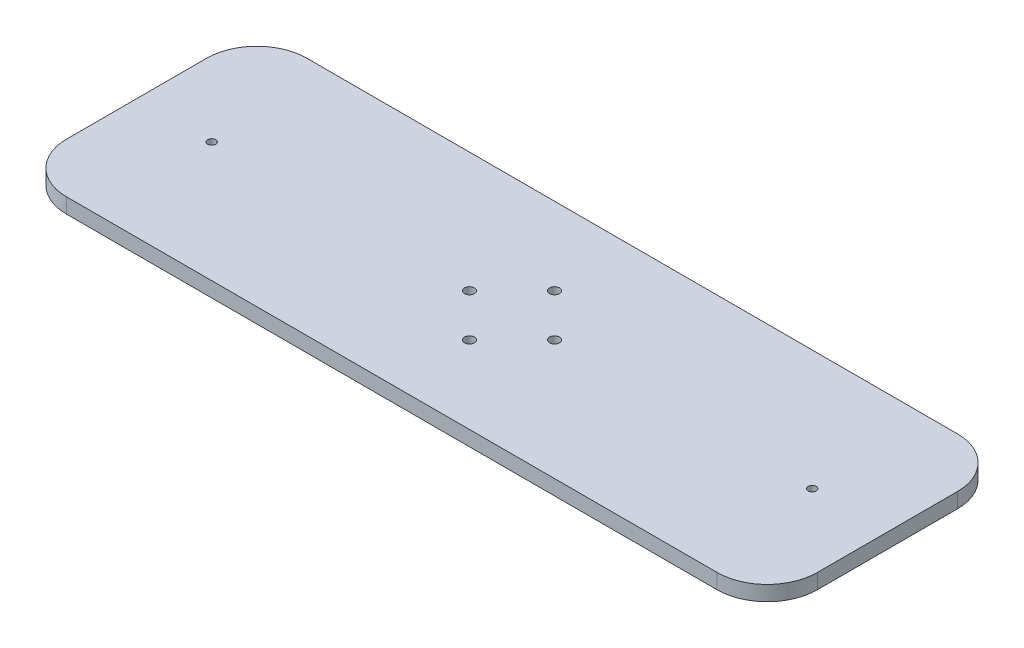
from build123d import *

# Parameters (mm, degrees)
SKETCH1_W           = 150
SKETCH1_H           = 48
BOSS_EXTRUDE1_DEPTH = 3
FILLET1_R           = 10
SKETCH2_R           = 0.8
CUT_EXTRUDE1_DEPTH  = 79.803553219
SKETCH3_R           = 1
CUT_EXTRUDE2_DEPTH  = 79.803553219


with BuildPart() as part:
    # Sketch1 → Boss-Extrude1 (new body)
    with BuildSketch(Plane(origin=(0, 0, 0), x_dir=(1, 0, 0), z_dir=(0, 1, 0))):
        Rectangle(SKETCH1_W, SKETCH1_H)
    extrude(amount=BOSS_EXTRUDE1_DEPTH)

    # Fillet1
    fillet1_edges = [part.edges().sort_by_distance(p)[0] for p in [
        (-75, 1.5, -24),
        (75, 1.5, -24),
        (75, 1.5, 24),
        (-75, 1.5, 24),
    ]]
    fillet(fillet1_edges, radius=FILLET1_R)

    # Sketch2 → Cut-Extrude1 (cut, through all)
    with BuildSketch(Plane(origin=(0, 3, 0), x_dir=(1, 0, 0), z_dir=(0, 1, 0))):
        with Locations(Location((-60, 0, 0), (0, 0, 270))):
            Circle(SKETCH2_R)
        with Locations(Location((60, 0, 0), (0, 0, 270))):
            Circle(SKETCH2_R)
    extrude(amount=-CUT_EXTRUDE1_DEPTH, mode=Mode.SUBTRACT)

    # Sketch3 → Cut-Extrude2 (cut, through all)
    with BuildSketch(Plane(origin=(0, 3, 0), x_dir=(1, 0, 0), z_dir=(0, 1, 0))):
        with Locations(Location((-8.5, 0, 0), (0, 0, 270))):
            Circle(SKETCH3_R)
        with Locations(Location((8.5, 0, 0), (0, 0, 270))):
            Circle(SKETCH3_R)
        with Locations(Location((0, 8.5, 0), (0, 0, 270))):
            Circle(SKETCH3_R)
        with Locations(Location((0, -8.5, 0), (0, 0, 270))):
            Circle(SKETCH3_R)
    extrude(amount=-CUT_EXTRUDE2_DEPTH, mode=Mode.SUBTRACT)


solid = part.part
